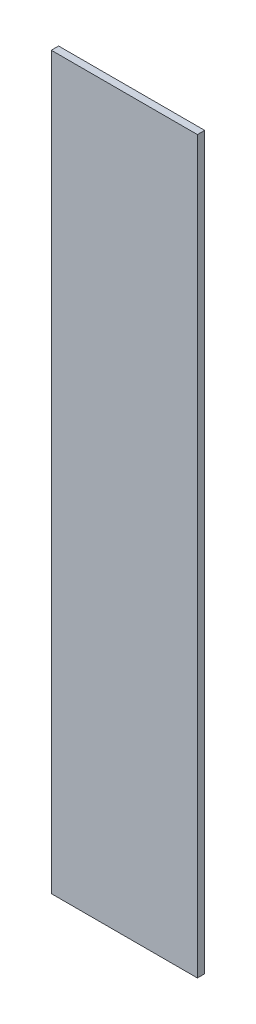
from build123d import *

# Parameters (mm, degrees)
SKETCH_1_W      = 20
SKETCH_1_H      = 100
EXTRUDE_1_DEPTH = 1


with BuildPart() as part:
    # 草图1 → 凸台-拉伸1 (new body)
    with BuildSketch(Plane.XY):
        with Locations((23.423180593, -2.964959569)):
            Rectangle(SKETCH_1_W, SKETCH_1_H)
    extrude(amount=EXTRUDE_1_DEPTH)


solid = part.part
